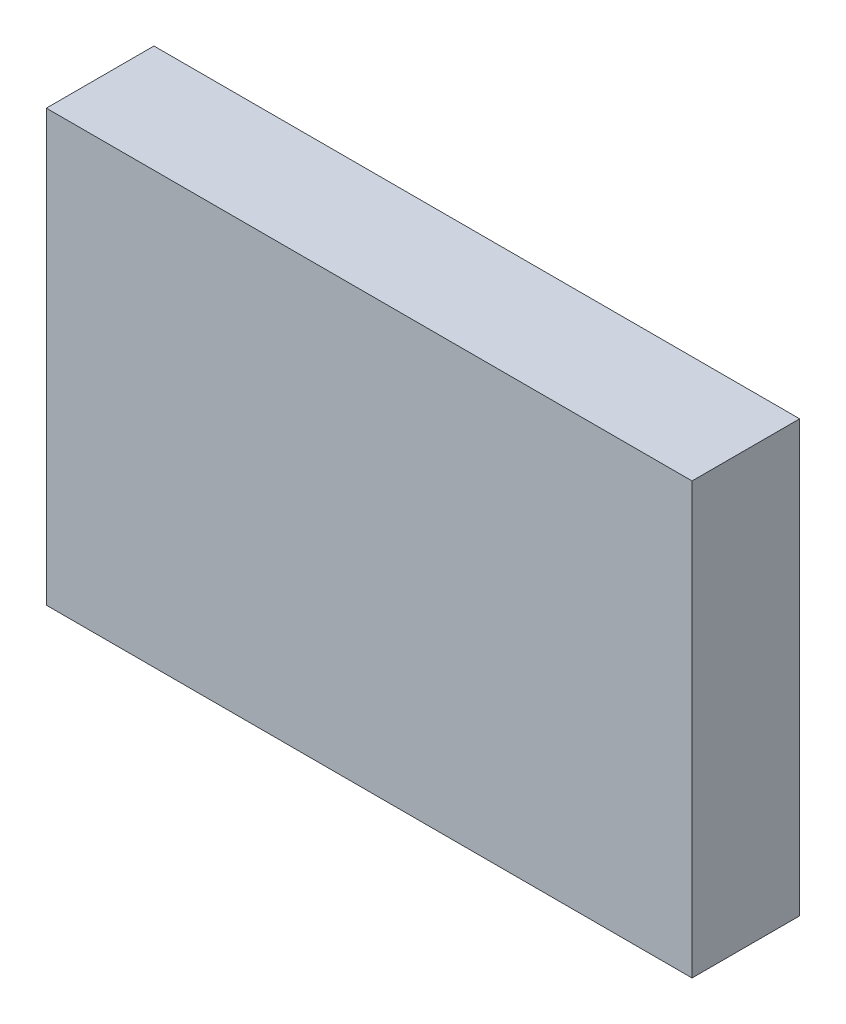
from build123d import *

# Parameters (mm, degrees)
SKETCH1_W           = 30
SKETCH1_H           = 20
BOSS_EXTRUDE1_DEPTH = 5


with BuildPart() as part:
    # Sketch1 → Boss-Extrude1 (new body)
    with BuildSketch(Plane.XY):
        Rectangle(SKETCH1_W, SKETCH1_H)
    extrude(amount=BOSS_EXTRUDE1_DEPTH)


solid = part.part
